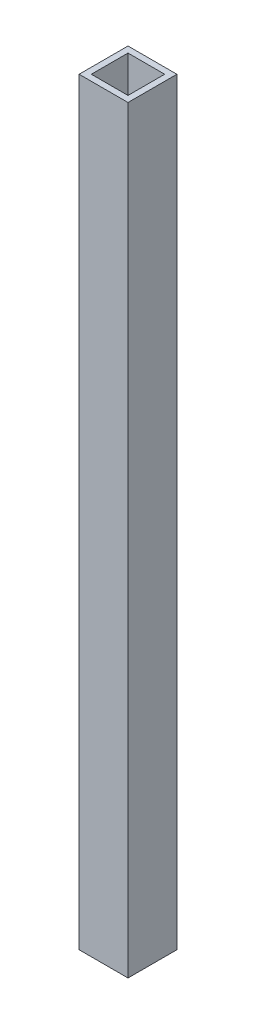
from build123d import *

# Parameters (mm, degrees)
SKETCH1_W           = 12.7
SKETCH1_H           = 12.7
SKETCH1_W_2         = 9.525
SKETCH1_H_2         = 9.525
BOSS_EXTRUDE1_DEPTH = 196.85


with BuildPart() as part:
    # Sketch1 → Boss-Extrude1 (new body)
    with BuildSketch(Plane(origin=(0, 0, 0), x_dir=(1, 0, 0), z_dir=(0, 1, 0))):
        Rectangle(SKETCH1_W, SKETCH1_H)
        Rectangle(SKETCH1_W_2, SKETCH1_H_2, mode=Mode.SUBTRACT)
    extrude(amount=BOSS_EXTRUDE1_DEPTH)


solid = part.part
